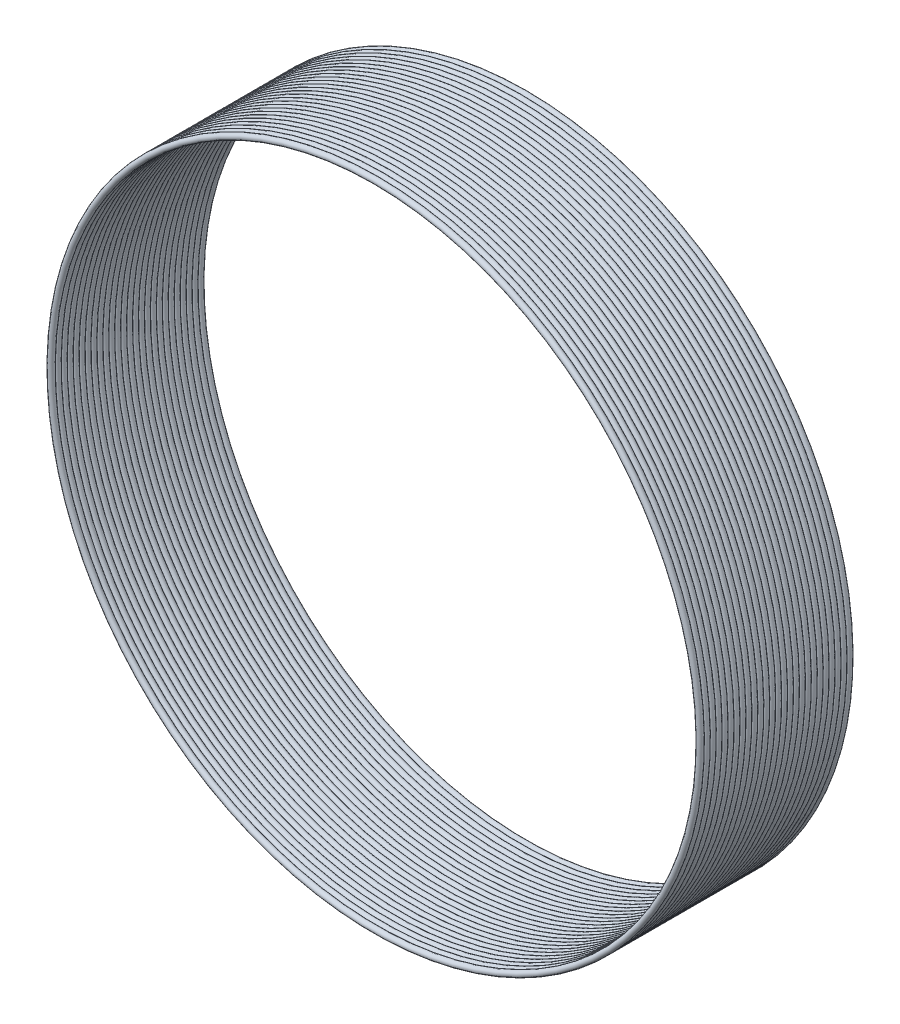
from build123d import *

# Parameters (mm, degrees)
SKETCH2_R       = 0.875
LPATTERN1_COUNT = 26
LPATTERN1_PITCH = 1.74


with BuildPart() as part:
    # Sweep1: sweep along a path in Sketch1
    with BuildLine(Plane.XY) as sweep1_path:
        CenterArc((0, 0), 95, 0, 360)
    # Sketch2 → Sweep1 (sweep)
    with BuildSketch(Plane(origin=(0, 0, 0), x_dir=(0, 0, -1), z_dir=(1, 0, 0))):
        with Locations((0, 95)):
            Circle(SKETCH2_R)
    sweep1 = sweep(path=sweep1_path.line)

    # LPattern1: Sweep1 ×26
    with Locations(*[(0, 0, -i * LPATTERN1_PITCH) for i in range(1, LPATTERN1_COUNT)]):
        add(sweep1)


solid = part.part
